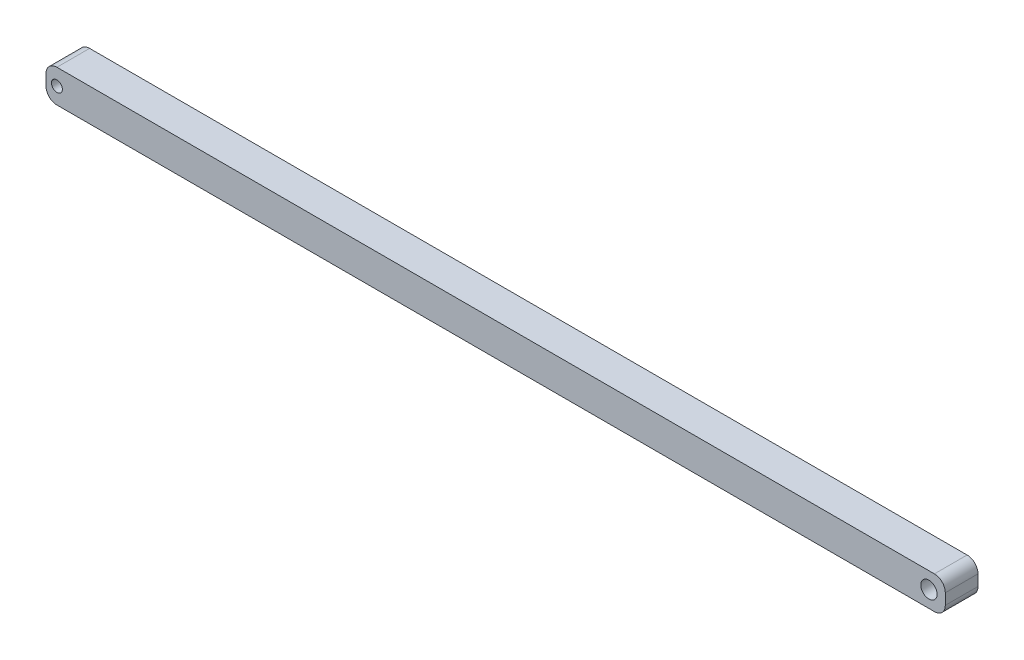
from build123d import *

# Parameters (mm, degrees)
ESQUISSE1_W             = 165
ESQUISSE1_H             = 6
BOSS_EXTRU_1_DEPTH      = 6
ESQUISSE2_R             = 1.5
ESQUISSE2_R_2           = 1
ENL_V_MAT_EXTRU_1_DEPTH = 166.218037756
CONG_1_R                = 2


with BuildPart() as part:
    # Esquisse1 → Boss.-Extru.1 (new body)
    with BuildSketch(Plane.XY):
        with Locations((82.5, 3)):
            Rectangle(ESQUISSE1_W, ESQUISSE1_H)
    extrude(amount=BOSS_EXTRU_1_DEPTH)

    # Esquisse2 → Enlèv. mat.-Extru.1 (cut, through all)
    with BuildSketch(Plane.XY.offset(6)):
        with Locations((162, 3)):
            Circle(ESQUISSE2_R)
        with Locations((2, 3)):
            Circle(ESQUISSE2_R_2)
    extrude(amount=-ENL_V_MAT_EXTRU_1_DEPTH, mode=Mode.SUBTRACT)

    # Congé1
    cong_1_edges = [part.edges().sort_by_distance(p)[0] for p in [
        (0, 6, 3),
        (165, 6, 3),
        (165, 0, 3),
        (0, 0, 3),
    ]]
    fillet(cong_1_edges, radius=CONG_1_R)


solid = part.part
